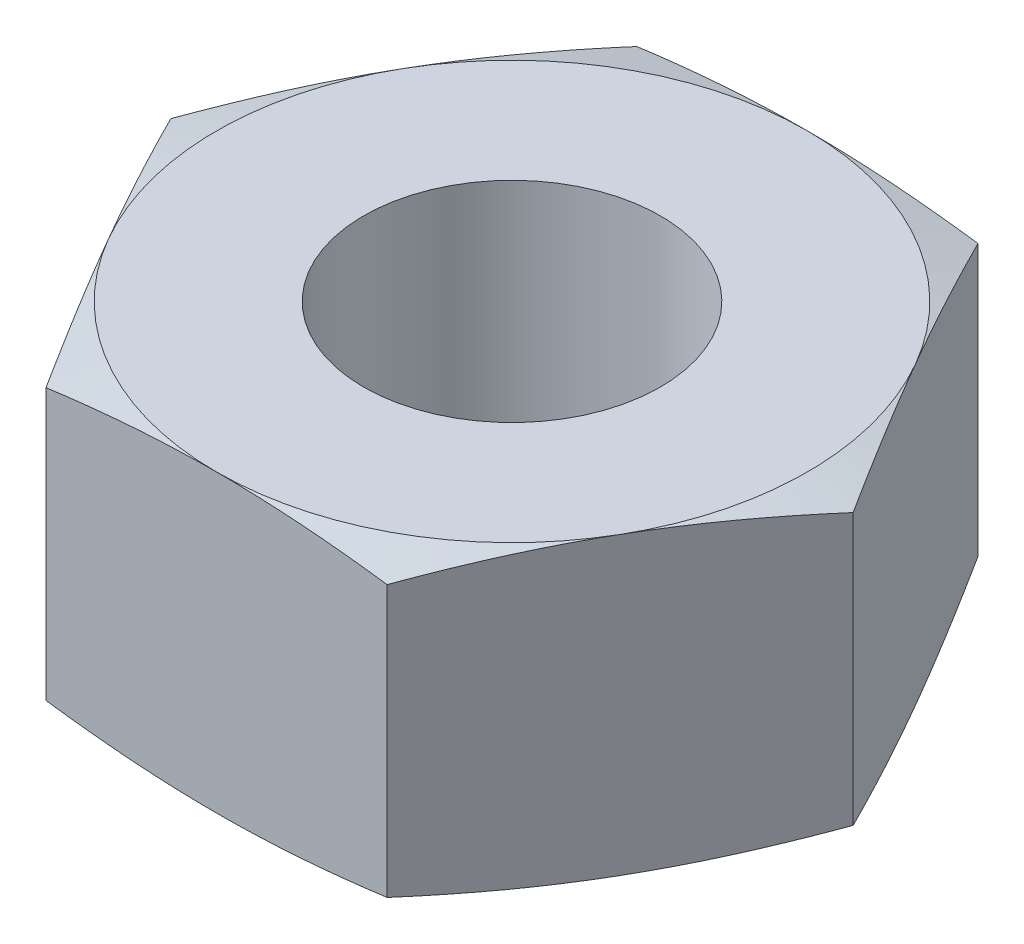
from build123d import *

# Parameters (mm, degrees)
EXTRUDE1_DEPTH = 2
SKETCH3_R      = 2.009
EXTRUDE2_DEPTH = 8.302967433


with BuildPart() as part:
    # Sketch1 → Extrude1 (new, symmetric)
    with BuildSketch(Plane(origin=(0, 0, 0), x_dir=(1, 0, 0), z_dir=(0, 1, 0))):
        Polygon((4.618802154, 0), (2.309401077, 4), (-2.309401077, 4), (-4.618802154, 0), (-2.309401077, -4), (2.309401077, -4), align=None)
    extrude(amount=EXTRUDE1_DEPTH, both=True)

    # Sketch2 → Cut-Revolve1 (revolve, cut)
    with BuildSketch(Plane(origin=(0, 0, 0), x_dir=(0, 0, -1), z_dir=(1, 0, 0))):
        Polygon((-4, 2), (-78.063973132, -17.845381789), (-78.063973132, 2), align=None)
    cut_revolve1 = revolve(axis=Axis((0, 0, 0), (0, 1, 0)), mode=Mode.SUBTRACT)

    # Mirror1: Cut-Revolve1 across plane
    add(cut_revolve1.mirror(Plane.ZX), mode=Mode.SUBTRACT)

    # Sketch3 → Extrude2 (cut, through all)
    with BuildSketch(Plane(origin=(0, 2, 0), x_dir=(1, 0, 0), z_dir=(0, 1, 0))):
        with Locations(Location((0, 0, 0), (0, 0, 270))):
            Circle(SKETCH3_R)
    extrude(amount=-EXTRUDE2_DEPTH, mode=Mode.SUBTRACT)


solid = part.part
